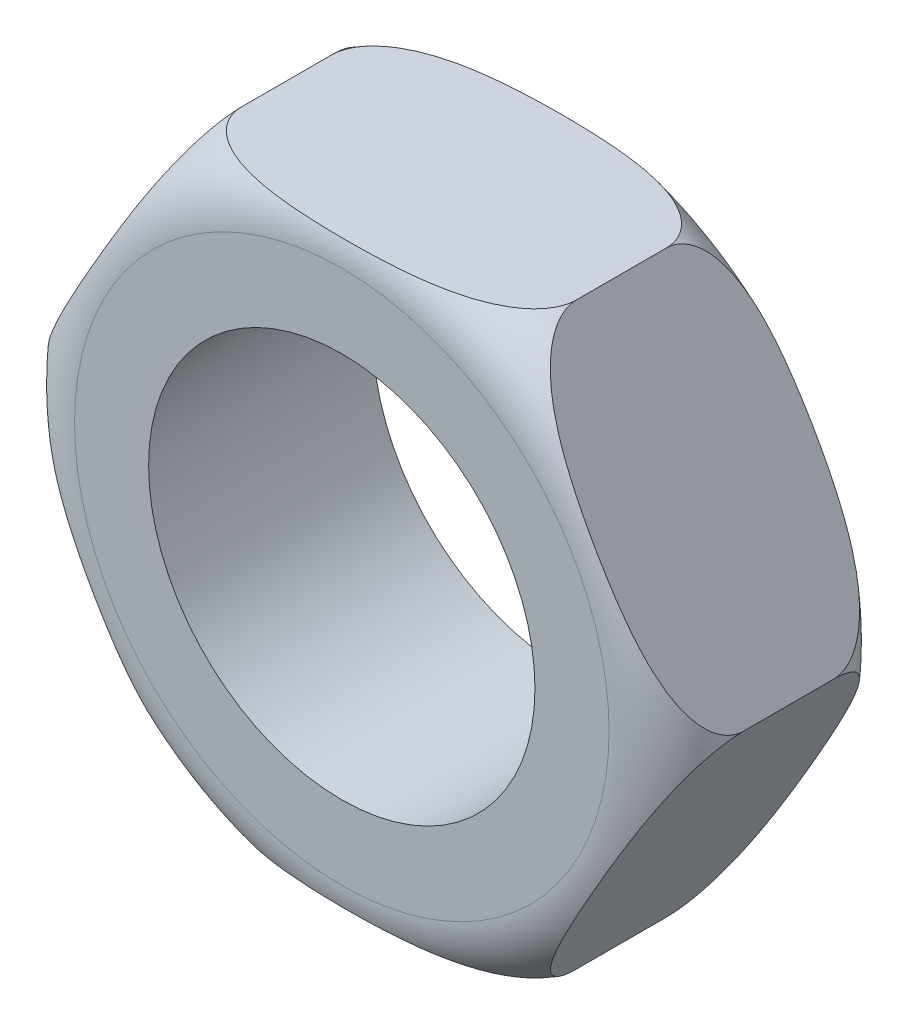
from build123d import *

# Parameters (mm, degrees)
SKETCH1_R          = 7.9375
BASE_EXTRUDE_DEPTH = 4.6101


with BuildPart() as part:
    # Sketch1 → Base-Extrude (new, symmetric)
    with BuildSketch(Plane.XY):
        Polygon((13.748153285, 0), (6.874076643, 11.90625), (-6.874076643, 11.90625), (-13.748153285, 0), (-6.874076643, -11.90625), (6.874076643, -11.90625), align=None)
        Circle(SKETCH1_R, mode=Mode.SUBTRACT)
    extrude(amount=BASE_EXTRUDE_DEPTH, both=True)

    # Sketch2 → Cut-Revolve1 (revolve, cut)
    with BuildSketch(Plane(origin=(0, 0, 0), x_dir=(1, 0, 0), z_dir=(0, 1, 0))):
        with BuildLine():
            Line((13.748153285, 4.6101), (13.748153285, 1.84404))
            ThreePointArc((13.748153285, 1.84404), (12.937993068, 3.799939783), (10.982093285, 4.6101))
            Line((10.982093285, 4.6101), (13.748153285, 4.6101))
        make_face()
        with BuildLine():
            Line((13.748153285, -4.6101), (10.982093285, -4.6101))
            ThreePointArc((10.982093285, -4.6101), (12.937993068, -3.799939783), (13.748153285, -1.84404))
            Line((13.748153285, -1.84404), (13.748153285, -4.6101))
        make_face()
    revolve(axis=Axis((0, 0, 0), (0, 0, -1)), mode=Mode.SUBTRACT)


solid = part.part
